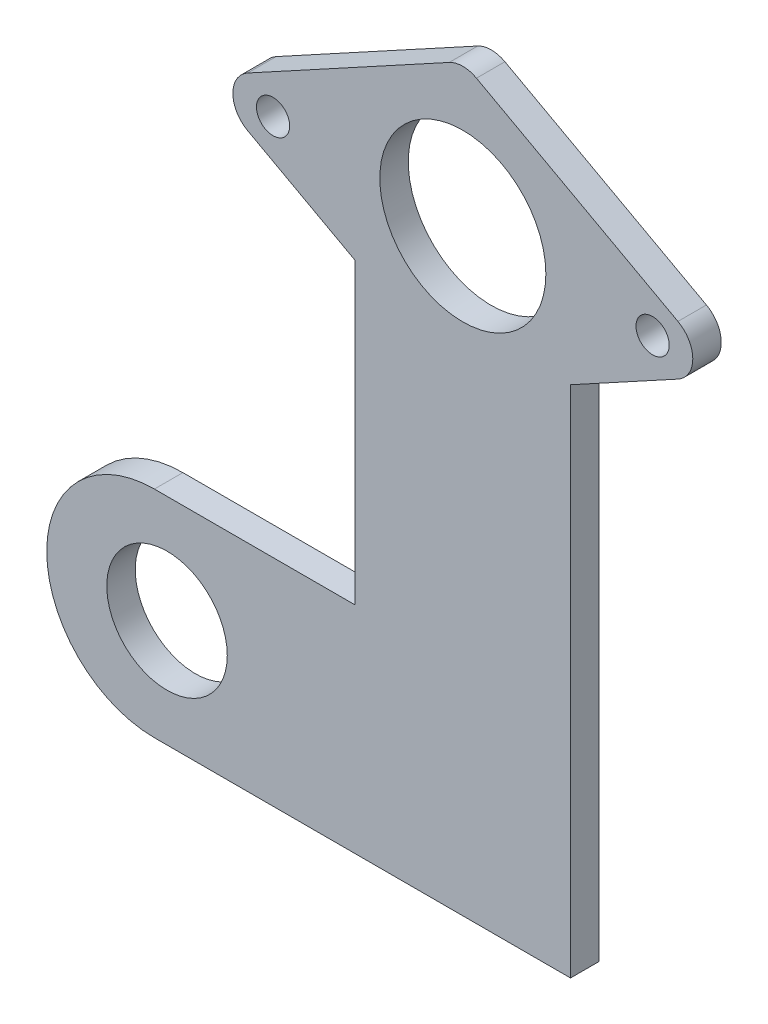
from build123d import *

# Parameters (mm, degrees)
SKETCH1_R           = 3.5
SKETCH1_R_2         = 17.5
SKETCH1_R_3         = 12.7
BOSS_EXTRUDE1_DEPTH = 6


with BuildPart() as part:
    # Sketch1 → Boss-Extrude1 (new body)
    with BuildSketch(Plane.XY):
        with BuildLine():
            Line((-45.343148698, -5.267373437), (-22.7, -17.618181818))
            Line((-22.7, -17.618181818), (-22.7, -80.51))
            Line((-22.7, -80.51), (-65.01, -80.51))
            ThreePointArc((-65.01, -80.51), (-81.054252865, -87.155747135), (-87.7, -103.2))
            Line((-87.7, -103.2), (-87.7, -103.22))
            ThreePointArc((-87.7, -103.22), (-81.054252865, -119.264252865), (-65.01, -125.91))
            Line((-65.01, -125.91), (22.7, -125.91))
            Line((22.7, -125.91), (22.7, -17.618181818))
            Line((22.7, -17.618181818), (45.343148698, -5.267373437))
            ThreePointArc((45.343148698, -5.267373437), (47.629429129, -3.062786582), (48.470035914, 0))
            ThreePointArc((48.470035914, 0), (47.629429129, 3.062786582), (45.343148698, 5.267373437))
            Line((45.343148698, 5.267373437), (2.873112784, 28.432847572))
            ThreePointArc((2.873112784, 28.432847572), (0, 29.165474135), (-2.873112784, 28.432847572))
            Line((-2.873112784, 28.432847572), (-45.343148698, 5.267373437))
            ThreePointArc((-45.343148698, 5.267373437), (-48.470035914, 0), (-45.343148698, -5.267373437))
        make_face()
        with Locations((-40, 0)):
            Circle(SKETCH1_R, mode=Mode.SUBTRACT)
        Circle(SKETCH1_R_2, mode=Mode.SUBTRACT)
        with Locations((40, 0)):
            Circle(SKETCH1_R, mode=Mode.SUBTRACT)
        with Locations((-62.35, -103.21)):
            Circle(SKETCH1_R_3, mode=Mode.SUBTRACT)
    extrude(amount=BOSS_EXTRUDE1_DEPTH)


solid = part.part
